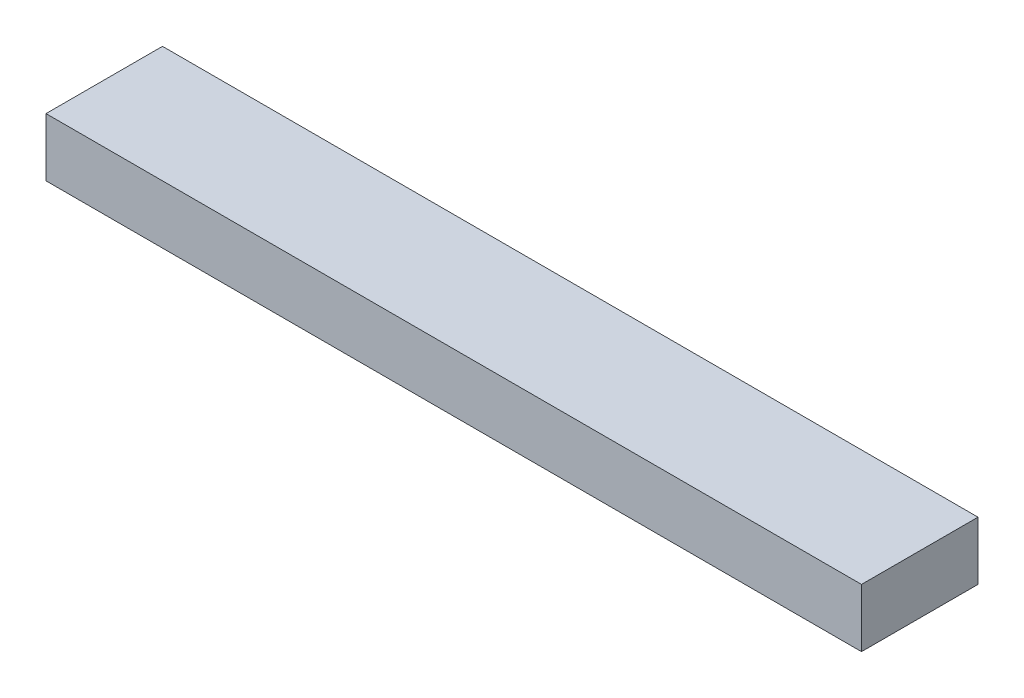
from build123d import *

# Parameters (mm, degrees)
SKETCH1_W           = 177.8
SKETCH1_H           = 25.4
BOSS_EXTRUDE1_DEPTH = 12.7


with BuildPart() as part:
    # Sketch1 → Boss-Extrude1 (new body)
    with BuildSketch(Plane(origin=(0, 0, 0), x_dir=(1, 0, 0), z_dir=(0, 1, 0))):
        with Locations((88.9, 12.7)):
            Rectangle(SKETCH1_W, SKETCH1_H)
    extrude(amount=BOSS_EXTRUDE1_DEPTH)


solid = part.part
